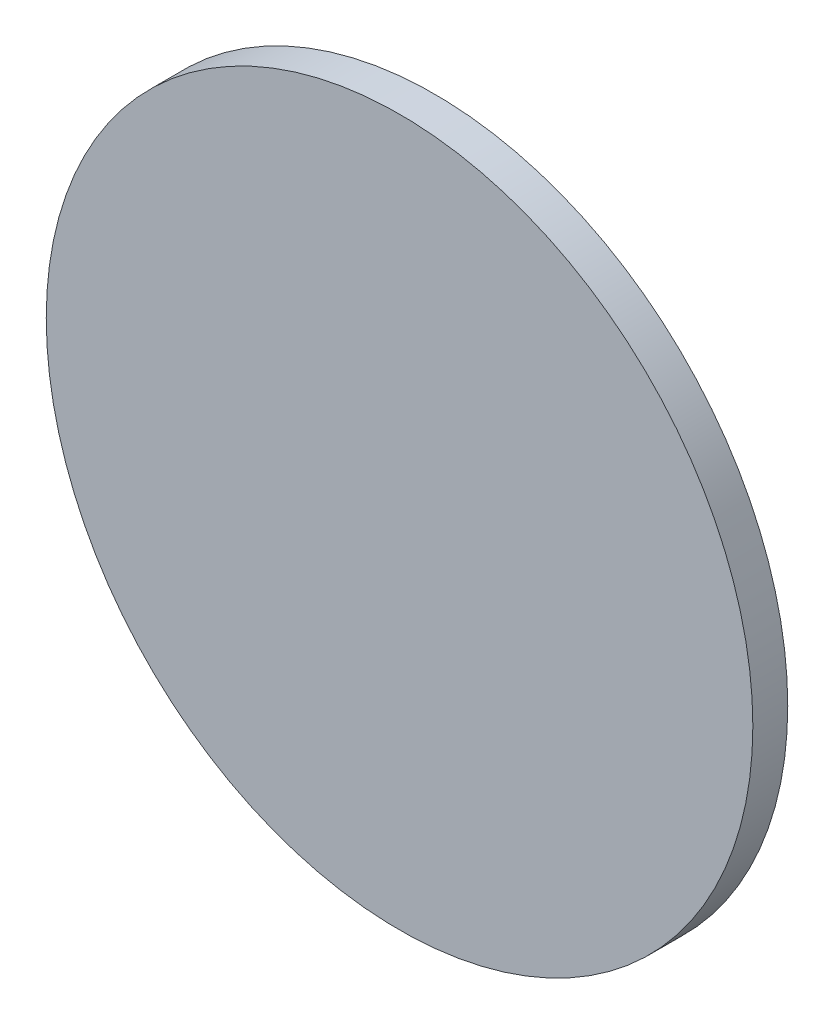
from build123d import *

# Parameters (mm, degrees)
SKETCH1_R           = 16.9672
BOSS_EXTRUDE1_DEPTH = 1.6764


with BuildPart() as part:
    # Sketch1 → Boss-Extrude1 (new body)
    with BuildSketch(Plane.XY):
        Circle(SKETCH1_R)
    extrude(amount=BOSS_EXTRUDE1_DEPTH)


solid = part.part
